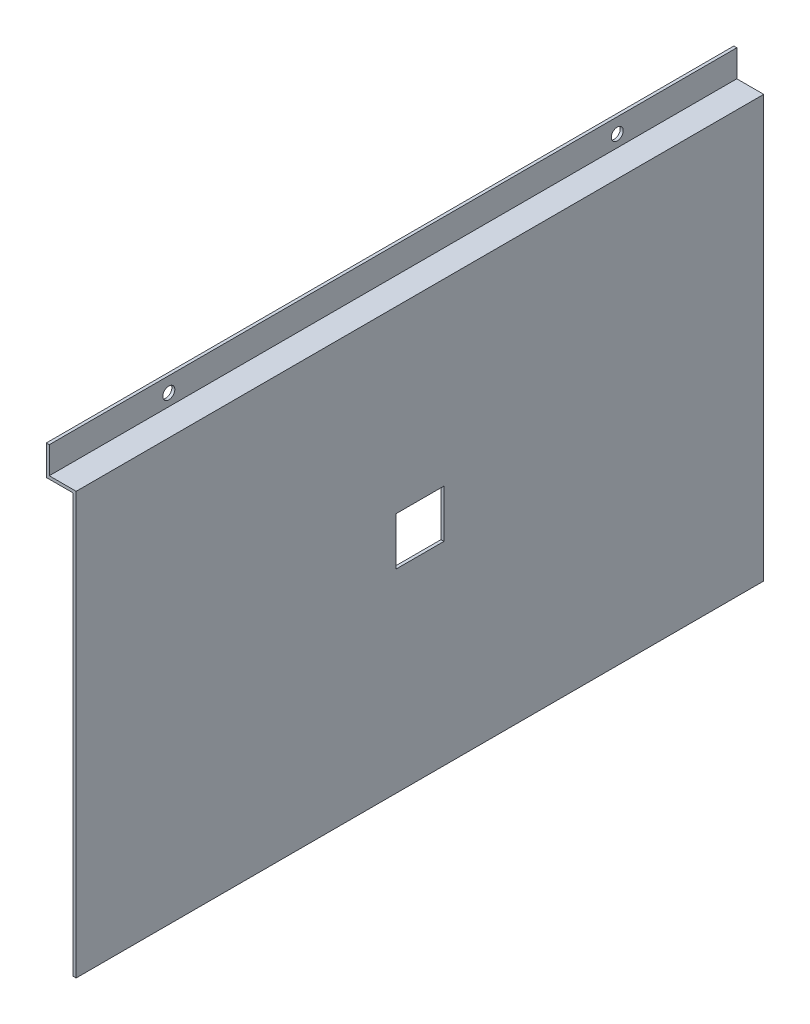
from build123d import *

# Parameters (mm, degrees)
EXTRUIR_L_MINA1_DEPTH = 230
CROQUIS2_R            = 2
CORTAR_EXTRUIR1_DEPTH = 1
CROQUIS3_W            = 16.026065554
CROQUIS3_H            = 16.026065555
CORTAR_EXTRUIR2_DEPTH = 1


with BuildPart() as part:
    # Croquis1 → Extruir-Lámina1 (new body)
    with BuildSketch(Plane.XY):
        Polygon((-38.118921946, 44.586627311), (-38.118921946, 34.586627311), (-29.118921946, 34.586627311), (-29.118921946, -105.413372689), (-28.118921946, -105.413372689), (-28.118921946, 35.586627311), (-37.118921946, 35.586627311), (-37.118921946, 44.586627311), align=None)
    extrude(amount=EXTRUIR_L_MINA1_DEPTH)

    # Croquis2 → Cortar-Extruir1 (cut)
    with BuildSketch(Plane(origin=(-37.118921946, 0, 0), x_dir=(0, 0, -1), z_dir=(1, 0, 0))):
        with Locations((-190, 39.586627311)):
            Circle(CROQUIS2_R)
        with Locations((-40, 39.586627311)):
            Circle(CROQUIS2_R)
    extrude(amount=-CORTAR_EXTRUIR1_DEPTH, mode=Mode.SUBTRACT)

    # Croquis3 → Cortar-Extruir2 (cut)
    with BuildSketch(Plane(origin=(-28.118921946, 0, 0), x_dir=(0, 0, -1), z_dir=(1, 0, 0))):
        with Locations((-115, -32.426405467)):
            Rectangle(CROQUIS3_W, CROQUIS3_H)
    extrude(amount=-CORTAR_EXTRUIR2_DEPTH, mode=Mode.SUBTRACT)


solid = part.part
